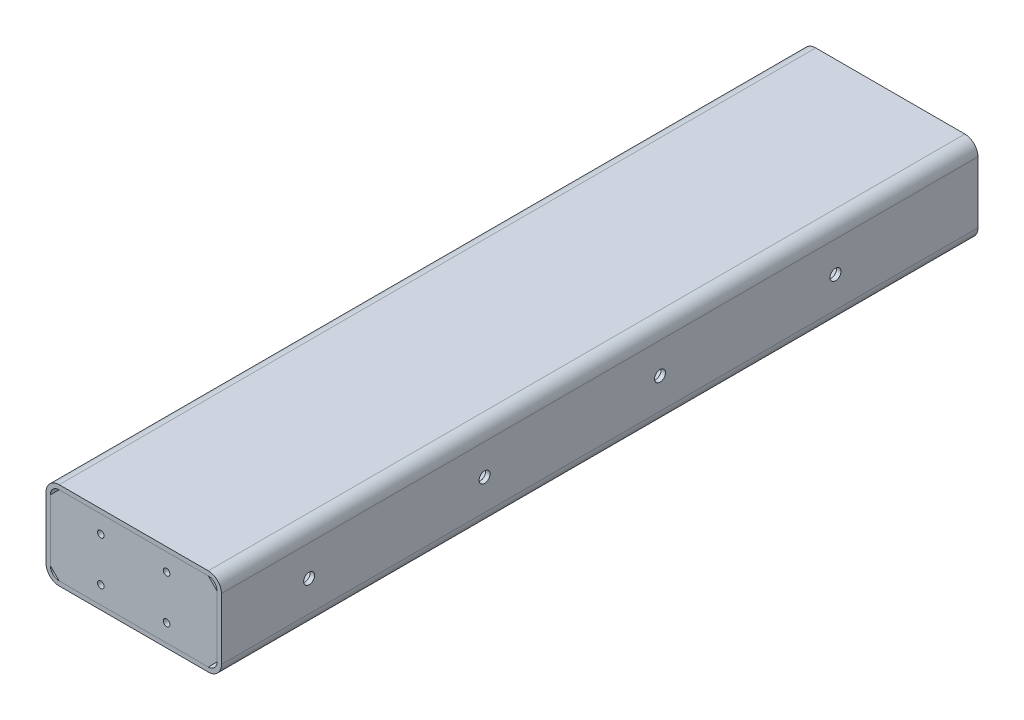
from build123d import *

# Parameters (mm, degrees)
AUFSATZ_LINEAR_AUSTRAGEN1_DEPTH = 345
AUFSATZ_LINEAR_AUSTRAGEN2_DEPTH = 5
AUFSATZ_LINEAR_AUSTRAGEN3_DEPTH = 5
SKIZZE4_R                       = 2.5
SCHNITT_LINEAR_AUSTRAGEN1_DEPTH = 100
SKIZZE5_R                       = 1.5
SCHNITT_LINEAR_AUSTRAGEN2_DEPTH = 10
SKIZZE6_R                       = 1.5
SCHNITT_LINEAR_AUSTRAGEN3_DEPTH = 10


with BuildPart() as part:
    # Skizze1 → Aufsatz-Linear austragen1 (new body)
    with BuildSketch(Plane.XY):
        with BuildLine():
            Line((-34, 20), (34, 20))
            ThreePointArc((34, 20), (38.242640687, 18.242640687), (40, 14))
            Line((40, 14), (40, -14))
            ThreePointArc((40, -14), (38.242640687, -18.242640687), (34, -20))
            Line((34, -20), (-34, -20))
            ThreePointArc((-34, -20), (-38.242640687, -18.242640687), (-40, -14))
            Line((-40, -14), (-40, 14))
            ThreePointArc((-40, 14), (-38.242640687, 18.242640687), (-34, 20))
        make_face()
        with BuildLine():
            Line((-38, 14), (-38, -14))
            ThreePointArc((-38, -14), (-36.828427125, -16.828427125), (-34, -18))
            Line((-34, -18), (34, -18))
            ThreePointArc((34, -18), (36.828427125, -16.828427125), (38, -14))
            Line((38, -14), (38, 14))
            ThreePointArc((38, 14), (36.828427125, 16.828427125), (34, 18))
            Line((34, 18), (-34, 18))
            ThreePointArc((-34, 18), (-36.828427125, 16.828427125), (-38, 14))
        make_face(mode=Mode.SUBTRACT)
    extrude(amount=AUFSATZ_LINEAR_AUSTRAGEN1_DEPTH)

    # Skizze4 → Schnitt-Linear austragen1 (cut)
    with BuildSketch(Plane(origin=(40, 0, 0), x_dir=(0, 0, -1), z_dir=(1, 0, 0))):
        with Locations((-305, 0)):
            Circle(SKIZZE4_R)
        with Locations((-225, 0)):
            Circle(SKIZZE4_R)
        with Locations((-145, 0)):
            Circle(SKIZZE4_R)
        with Locations((-65, 0)):
            Circle(SKIZZE4_R)
    extrude(amount=-SCHNITT_LINEAR_AUSTRAGEN1_DEPTH, mode=Mode.SUBTRACT)


with BuildPart() as body_2:
    # Skizze2 → Aufsatz-Linear austragen2 (new body)
    with BuildSketch(Plane(origin=(0, 0, 0), x_dir=(-1, 0, 0), z_dir=(0, 0, -1))):
        Polygon((38, 14), (38, -14), (34, -18), (-34, -18), (-38, -14), (-38, 14), (-34, 18), (34, 18), align=None)
    extrude(amount=-AUFSATZ_LINEAR_AUSTRAGEN2_DEPTH)

    # Skizze5 → Schnitt-Linear austragen2 (cut)
    with BuildSketch(Plane(origin=(0, 0, 0), x_dir=(-1, 0, 0), z_dir=(0, 0, -1))):
        with Locations((20, 0)):
            Circle(SKIZZE5_R)
        with Locations(Location((-20, 0, 0), (0, 0, 180))):
            Circle(SKIZZE5_R)
    extrude(amount=-SCHNITT_LINEAR_AUSTRAGEN2_DEPTH, mode=Mode.SUBTRACT)


with BuildPart() as body_3:
    # Skizze3 → Aufsatz-Linear austragen3 (new body)
    with BuildSketch(Plane.XY.offset(345)):
        Polygon((34, 18), (38, 14), (38, -14), (34, -18), (-34, -18), (-38, -14), (-38, 14), (-34, 18), align=None)
    extrude(amount=-AUFSATZ_LINEAR_AUSTRAGEN3_DEPTH)

    # Skizze6 → Schnitt-Linear austragen3 (cut)
    with BuildSketch(Plane.XY.offset(345)):
        with Locations((15, 10)):
            Circle(SKIZZE6_R)
        with Locations(Location((-15, 10, 0), (0, 0, 180))):
            Circle(SKIZZE6_R)
        with Locations(Location((15, -10, 0), (0, 0, 180))):
            Circle(SKIZZE6_R)
        with Locations((-15, -10)):
            Circle(SKIZZE6_R)
    extrude(amount=-SCHNITT_LINEAR_AUSTRAGEN3_DEPTH, mode=Mode.SUBTRACT)


solid = Compound([part.part, body_2.part, body_3.part])
